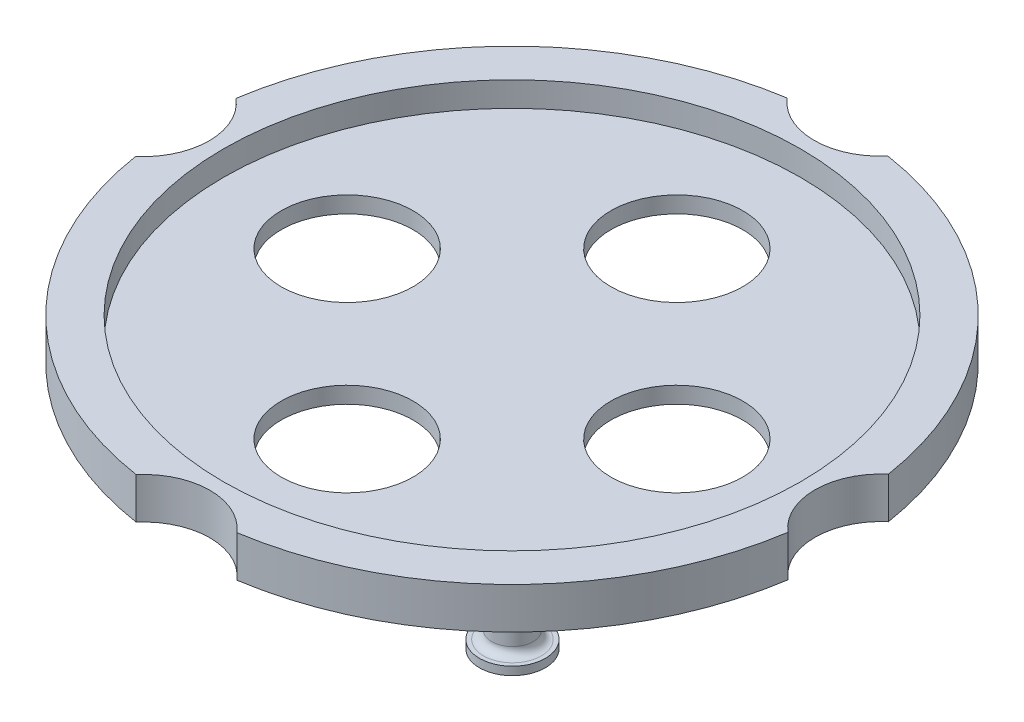
from build123d import *

# Parameters (mm, degrees)
SKETCH1_R                = 50.8
BOSS_EXTRUDE1_DEPTH      = 6.35
SKETCH2_R                = 44.45
CUT_EXTRUDE1_DEPTH       = 3.81
SKETCH3_R                = 10.16
CUT_EXTRUDE2_DEPTH       = 73.122135992
SKETCH5_R                = 3.175
BOSS_EXTRUDE3_DEPTH      = 6.35
SKETCH6_R                = 5.08
BOSS_EXTRUDE4_DEPTH      = 1.27
FILLET1_R                = 1.27
CIRPATTERN1_COUNT        = 4
FILLET1_OF_CIRPATTERN1_R = 1.27


with BuildPart() as part:
    # Sketch1 → Boss-Extrude1 (new body)
    with BuildSketch(Plane(origin=(0, 0, 0), x_dir=(1, 0, 0), z_dir=(0, 1, 0))):
        with Locations(Location((0, 0, 0), (0, 0, 270))):
            Circle(SKETCH1_R)
    extrude(amount=BOSS_EXTRUDE1_DEPTH)

    # Sketch2 → Cut-Extrude1 (cut)
    with BuildSketch(Plane(origin=(0, 6.35, 0), x_dir=(1, 0, 0), z_dir=(0, 1, 0))):
        with Locations(Location((0, 0, 0), (0, 0, 270))):
            Circle(SKETCH2_R)
    extrude(amount=-CUT_EXTRUDE1_DEPTH, mode=Mode.SUBTRACT)

    # Sketch3 → Cut-Extrude2 (cut, through all)
    with BuildSketch(Plane(origin=(0, 6.35, 0), x_dir=(1, 0, 0), z_dir=(0, 1, 0))):
        with Locations(Location((-25.4, 0, 0), (0, 0, 270))):
            Circle(SKETCH3_R)
        with Locations(Location((0, 25.4, 0), (0, 0, 270))):
            Circle(SKETCH3_R)
        with Locations(Location((25.4, 0, 0), (0, 0, 270))):
            Circle(SKETCH3_R)
        with Locations(Location((0, -25.4, 0), (0, 0, 270))):
            Circle(SKETCH3_R)
        with BuildLine():
            ThreePointArc((50.197287423, 7.802072504), (46.618651681, 0.050767717), (50.214161259, -7.692724424))
            ThreePointArc((50.214161259, -7.692724424), (50.799969878, 0.055321173), (50.197287423, 7.802072504))
        make_face()
        with BuildLine():
            ThreePointArc((-7.692724424, -50.214161259), (0.055321173, -50.799969878), (7.802072504, -50.197287423))
            ThreePointArc((7.802072504, -50.197287423), (0.050767717, -46.618651681), (-7.692724424, -50.214161259))
        make_face()
        with BuildLine():
            ThreePointArc((-50.214161259, 7.692724424), (-50.799969878, -0.055321173), (-50.197287423, -7.802072504))
            ThreePointArc((-50.197287423, -7.802072504), (-46.618651681, -0.050767717), (-50.214161259, 7.692724424))
        make_face()
        with BuildLine():
            ThreePointArc((7.692724424, 50.214161259), (-0.055321173, 50.799969878), (-7.802072504, 50.197287423))
            ThreePointArc((-7.802072504, 50.197287423), (-0.050767717, 46.618651681), (7.692724424, 50.214161259))
        make_face()
    extrude(amount=-CUT_EXTRUDE2_DEPTH, mode=Mode.SUBTRACT)

    # Sketch5 → Boss-Extrude3 (add)
    with BuildSketch(Plane.XZ):
        with Locations(Location((-30.499602427, 30.566102987, 0), (0, 0, 90))):
            Circle(SKETCH5_R)
    boss_extrude3 = extrude(amount=BOSS_EXTRUDE3_DEPTH)

    # Sketch6 → Boss-Extrude4 (add)
    with BuildSketch(Plane.XZ.offset(6.35)):
        with Locations(Location((-30.499602427, 30.566102987, 0), (0, 0, 270))):
            Circle(SKETCH6_R)
    boss_extrude4 = extrude(amount=BOSS_EXTRUDE4_DEPTH)

    # Fillet1
    fillet1_edges = [part.edges().sort_by_distance(p)[0] for p in [
        (-30.499602427, 0, 27.391102987),
        (-30.499602427, -6.35, 27.391102987),
    ]]
    fillet(fillet1_edges, radius=FILLET1_R)

    # CirPattern1: Boss-Extrude3, Boss-Extrude4 ×4 about axis
    cirpattern1_axis = Axis((0, 0, 0), (0, 1, 0))
    add([boss_extrude3.rotate(cirpattern1_axis, i * 360 / CIRPATTERN1_COUNT) for i in range(1, CIRPATTERN1_COUNT)])
    add([boss_extrude4.rotate(cirpattern1_axis, i * 360 / CIRPATTERN1_COUNT) for i in range(1, CIRPATTERN1_COUNT)])

    # Fillet1 of CirPattern1
    fillet1_of_cirpattern1_edges = [part.edges().sort_by_distance(p)[0] for p in [
        (27.391102987, 0, 30.499602427),
        (27.391102987, -6.35, 30.499602427),
        (30.499602427, 0, -27.391102987),
        (30.499602427, -6.35, -27.391102987),
        (-27.391102987, 0, -30.499602427),
        (-27.391102987, -6.35, -30.499602427),
    ]]
    fillet(fillet1_of_cirpattern1_edges, radius=FILLET1_OF_CIRPATTERN1_R)


solid = part.part
